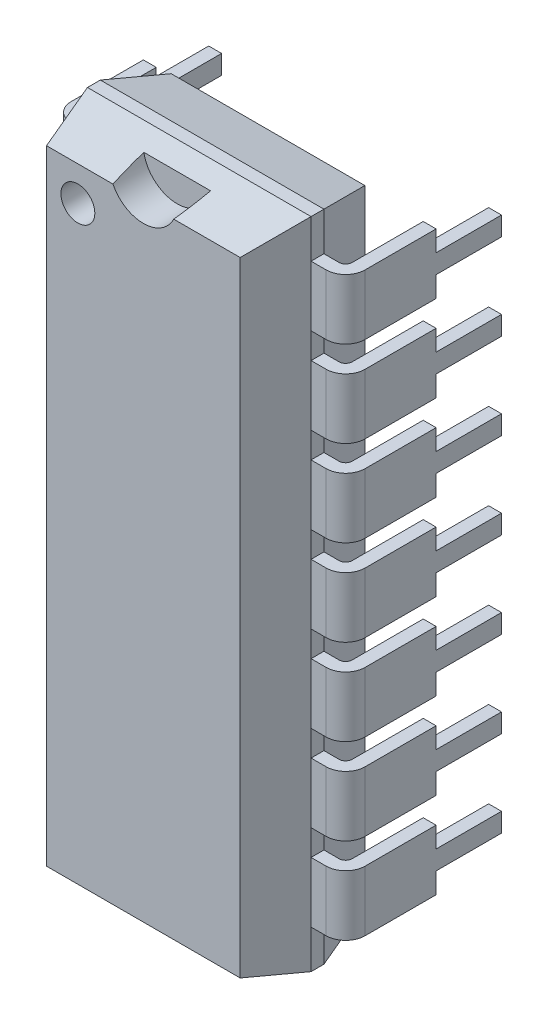
from build123d import *
from OCP.BRepFilletAPI import BRepFilletAPI_MakeChamfer

# Parameters (mm, degrees)
SKETCH_2_W          = 6.6
SKETCH_2_H          = 19.3
EXTRUDE_1_DEPTH     = 3.68
CHAMFER_1_SIZE      = 1.65
CHAMFER_1_SIZE2     = 0.442116168
SKETCH_1_W          = 0.38
SKETCH_1_H          = 1.78
SKETCH_4_W          = 0.38
SKETCH_4_H          = 1.78
SKETCH_6_R          = 1
SKETCH_6_R_2        = 0.5
CUT_EXTRUDE_1_DEPTH = 1
SKETCH_7_W          = 0.38
SKETCH_7_H          = 0.56
EXTRUDE_2_DEPTH     = 3.43
SKETCH_8_R          = 0.10717489
CUT_EXTRUDE_2_DEPTH = 3.5
SKETCH_9_W          = 13.11469623
SKETCH_9_H          = 21.838311133
CUT_EXTRUDE_3_DEPTH = 1.5


with BuildPart() as part:
    # Эскиз2 → Вытянуть1 (new body)
    with BuildSketch(Plane.XY.offset(4.32)):
        with Locations((4.13, -7.62)):
            Rectangle(SKETCH_2_W, SKETCH_2_H)
    extrude(amount=-EXTRUDE_1_DEPTH)

    # Фаска1: one chamfer whose edges measure the first distance from different faces: ONE call of the kernel's chamfer builder (chamfer() names one face for all edges)
    chamfer_1_edges_1 = [part.edges().sort_by_distance(p)[0] for p in [
        (7.43, -7.62, 0.64),
        (7.43, -7.62, 4.32),
    ]]
    chamfer_1_side_1 = [part.faces().sort_by_distance(p)[0] for p in [
        (7.43, -7.62, 2.48),
    ]]
    chamfer_1_edges_2 = [part.edges().sort_by_distance(p)[0] for p in [
        (4.13, 2.03, 0.64),
        (4.13, 2.03, 4.32),
    ]]
    chamfer_1_side_2 = [part.faces().sort_by_distance(p)[0] for p in [
        (4.13, 2.03, 2.48),
    ]]
    chamfer_1_edges_3 = [part.edges().sort_by_distance(p)[0] for p in [
        (0.83, -7.62, 0.64),
        (0.83, -7.62, 4.32),
    ]]
    chamfer_1_side_3 = [part.faces().sort_by_distance(p)[0] for p in [
        (0.83, -7.62, 2.48),
    ]]
    chamfer_1_edges_4 = [part.edges().sort_by_distance(p)[0] for p in [
        (4.13, -17.27, 4.32),
        (4.13, -17.27, 0.64),
    ]]
    chamfer_1_side_4 = [part.faces().sort_by_distance(p)[0] for p in [
        (4.13, -17.27, 2.48),
    ]]
    chamfer_1 = BRepFilletAPI_MakeChamfer(part.part.solid().wrapped)
    for e in chamfer_1_edges_1:
        chamfer_1.Add(CHAMFER_1_SIZE, CHAMFER_1_SIZE2, e.wrapped, chamfer_1_side_1[0].wrapped)  # the first distance lies on this face
    for e in chamfer_1_edges_2:
        chamfer_1.Add(CHAMFER_1_SIZE, CHAMFER_1_SIZE2, e.wrapped, chamfer_1_side_2[0].wrapped)  # the first distance lies on this face
    for e in chamfer_1_edges_3:
        chamfer_1.Add(CHAMFER_1_SIZE, CHAMFER_1_SIZE2, e.wrapped, chamfer_1_side_3[0].wrapped)  # the first distance lies on this face
    for e in chamfer_1_edges_4:
        chamfer_1.Add(CHAMFER_1_SIZE, CHAMFER_1_SIZE2, e.wrapped, chamfer_1_side_4[0].wrapped)  # the first distance lies on this face
    add(Compound.cast(chamfer_1.Shape()), mode=Mode.REPLACE)

    # По траектории3: sweep along a path in Эскиз3
    with BuildLine(Plane(origin=(0, 0, 0), x_dir=(1, 0, 0), z_dir=(0, 1, 0))) as sweep_3_path:
        Line((0, 0), (0, -2.133259053))
        ThreePointArc((0, -2.133259053), (0.109947155, -2.386876074), (0.370212222, -2.48))
        Line((0.370212222, -2.48), (0.83, -2.48))
    # Эскиз1 → По траектории3 (sweep)
    with BuildSketch(Plane.XY):
        Rectangle(SKETCH_1_W, SKETCH_1_H)
        with Locations((0, -2.54)):
            Rectangle(SKETCH_1_W, SKETCH_1_H)
        with Locations((0, -5.08)):
            Rectangle(SKETCH_1_W, SKETCH_1_H)
        with Locations((0, -7.62)):
            Rectangle(SKETCH_1_W, SKETCH_1_H)
        with Locations((0, -10.16)):
            Rectangle(SKETCH_1_W, SKETCH_1_H)
        with Locations((0, -12.7)):
            Rectangle(SKETCH_1_W, SKETCH_1_H)
        with Locations((0, -15.24)):
            Rectangle(SKETCH_1_W, SKETCH_1_H)
    sweep(path=sweep_3_path.line, transition=Transition.RIGHT)

    # По траектории4: sweep along a path in Эскиз5
    with BuildLine(Plane(origin=(0, 0, 0), x_dir=(1, 0, 0), z_dir=(0, 1, 0))) as sweep_4_path:
        Line((7.43, -2.48), (7.873732591, -2.48))
        ThreePointArc((7.873732591, -2.48), (8.146864964, -2.366864826), (8.26, -2.093732395))
        Line((8.26, -2.093732395), (8.26, 0))
    # Эскиз4 → По траектории4 (sweep)
    with BuildSketch(Plane.XY):
        with Locations((8.26, 0)):
            Rectangle(SKETCH_4_W, SKETCH_4_H)
        with Locations((8.26, -2.54)):
            Rectangle(SKETCH_4_W, SKETCH_4_H)
        with Locations((8.26, -5.08)):
            Rectangle(SKETCH_4_W, SKETCH_4_H)
        with Locations((8.26, -7.62)):
            Rectangle(SKETCH_4_W, SKETCH_4_H)
        with Locations((8.26, -10.16)):
            Rectangle(SKETCH_4_W, SKETCH_4_H)
        with Locations((8.26, -12.7)):
            Rectangle(SKETCH_4_W, SKETCH_4_H)
        with Locations((8.26, -15.24)):
            Rectangle(SKETCH_4_W, SKETCH_4_H)
    sweep(path=sweep_4_path.line)

    # Эскиз6 → Вырез-Вытянуть1 (cut)
    with BuildSketch(Plane.XY.offset(4.32)):
        with Locations((4.13, 2.03)):
            Circle(SKETCH_6_R)
        with Locations((2.197434959, 0.574075773)):
            Circle(SKETCH_6_R_2)
    extrude(amount=-CUT_EXTRUDE_1_DEPTH, mode=Mode.SUBTRACT)

    # Эскиз7 → Вытянуть2 (add)
    with BuildSketch(Plane(origin=(0, 0, 0), x_dir=(-1, 0, 0), z_dir=(0, 0, -1))):
        Rectangle(SKETCH_7_W, SKETCH_7_H)
        with Locations((-8.26, 0)):
            Rectangle(SKETCH_7_W, SKETCH_7_H)
        with Locations((0, -2.54)):
            Rectangle(SKETCH_7_W, SKETCH_7_H)
        with Locations((-8.26, -2.54)):
            Rectangle(SKETCH_7_W, SKETCH_7_H)
        with Locations((0, -5.08)):
            Rectangle(SKETCH_7_W, SKETCH_7_H)
        with Locations((-8.26, -5.08)):
            Rectangle(SKETCH_7_W, SKETCH_7_H)
        with Locations((0, -7.62)):
            Rectangle(SKETCH_7_W, SKETCH_7_H)
        with Locations((-8.26, -7.62)):
            Rectangle(SKETCH_7_W, SKETCH_7_H)
        with Locations((0, -10.16)):
            Rectangle(SKETCH_7_W, SKETCH_7_H)
        with Locations((-8.26, -10.16)):
            Rectangle(SKETCH_7_W, SKETCH_7_H)
        with Locations((0, -12.7)):
            Rectangle(SKETCH_7_W, SKETCH_7_H)
        with Locations((-8.26, -12.7)):
            Rectangle(SKETCH_7_W, SKETCH_7_H)
        with Locations((0, -15.24)):
            Rectangle(SKETCH_7_W, SKETCH_7_H)
        with Locations((-8.26, -15.24)):
            Rectangle(SKETCH_7_W, SKETCH_7_H)
    extrude(amount=EXTRUDE_2_DEPTH)

    # Эскиз8 → Вырез-Вытянуть2 (cut)
    with BuildSketch(Plane(origin=(0, 0, -3.43), x_dir=(-1, 0, 0), z_dir=(0, 0, -1))):
        Circle(SKETCH_8_R)
    extrude(amount=-CUT_EXTRUDE_2_DEPTH, mode=Mode.SUBTRACT)

    # Эскиз9 → Вырез-Вытянуть3 (cut)
    with BuildSketch(Plane(origin=(0, 0, -3.43), x_dir=(-1, 0, 0), z_dir=(0, 0, -1))):
        with Locations((-3.573796365, -7.605363063)):
            Rectangle(SKETCH_9_W, SKETCH_9_H)
    extrude(amount=-CUT_EXTRUDE_3_DEPTH, mode=Mode.SUBTRACT)


solid = part.part
